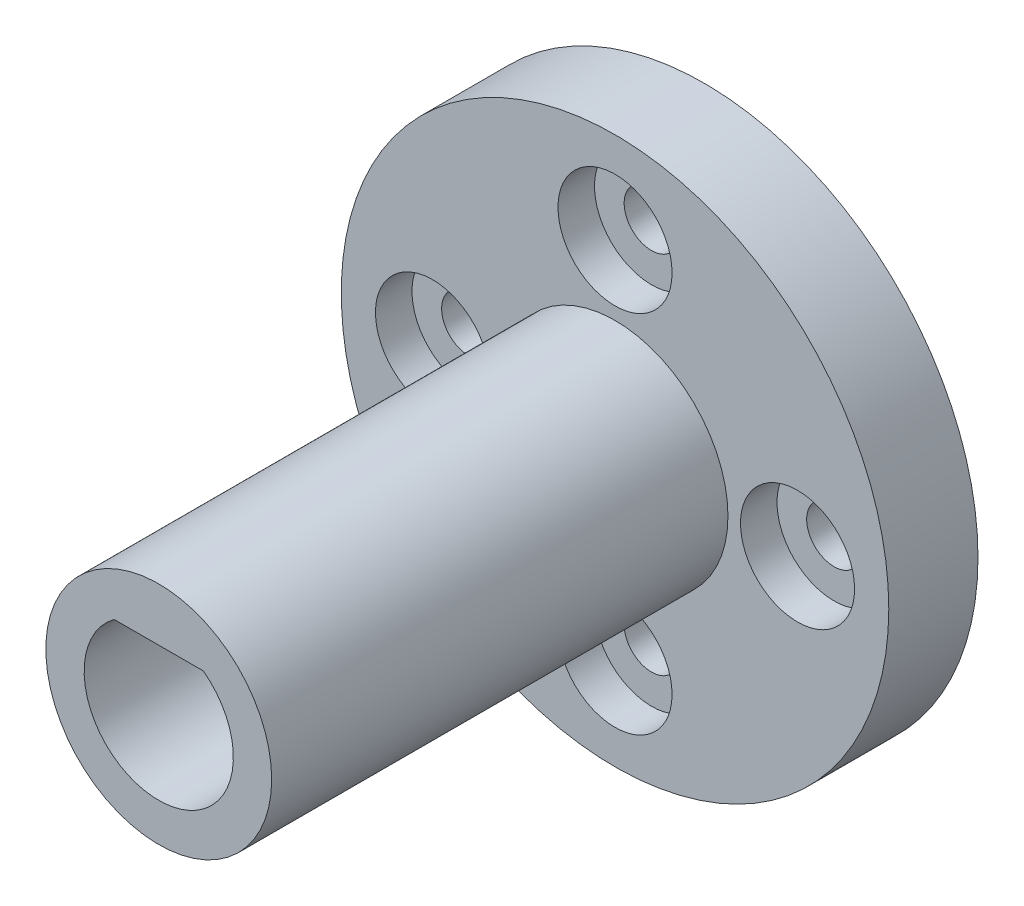
from build123d import *

# Parameters (mm, degrees)
ESQUISSE1_R                                        = 12
BOSS_EXTRU_1_DEPTH                                 = 3.91
ESQUISSE6_R                                        = 4
ENL_V_MAT_EXTRU_2_DEPTH                            = 1.91
BOSS_EXTRU_2_DEPTH                                 = 20
CHAMBRAGE_POUR_VIS_T_TE_RONDE_BOMB_E_M_D           = 2.4
CHAMBRAGE_POUR_VIS_T_TE_RONDE_BOMB_E_M_CBORE_D     = 5
CHAMBRAGE_POUR_VIS_T_TE_RONDE_BOMB_E_M_CBORE_DEPTH = 1.6
R_P_TITION_CIRCULAIRE2_COUNT                       = 4


with BuildPart() as part:
    # Esquisse1 → Boss.-Extru.1 (new body)
    with BuildSketch(Plane.XY):
        Circle(ESQUISSE1_R)
    extrude(amount=BOSS_EXTRU_1_DEPTH)

    # Esquisse6 → Enlèv. mat.-Extru.2 (cut)
    with BuildSketch(Plane(origin=(0, 0, 0), x_dir=(-1, 0, 0), z_dir=(0, 0, -1))):
        Circle(ESQUISSE6_R)
    extrude(amount=-ENL_V_MAT_EXTRU_2_DEPTH, mode=Mode.SUBTRACT)

    # Esquisse7 → Boss.-Extru.2 (add)
    # profile 1 of 2: a face of its own
    with BuildSketch(Plane.XY.offset(3.91)):
        with BuildLine():
            Line((-3.716127016, -3.27), (0, -3.27))
            Line((0, -3.27), (3.716127016, -3.27))
            ThreePointArc((3.716127016, -3.27), (4.631270276, -1.747522714), (4.95, 0))
            ThreePointArc((4.95, 0), (-1.747522714, 4.631270276), (-3.716127016, -3.27))
        make_face()
        with BuildLine():
            Line((-1.956655309, 2.62), (1.956655309, 2.62))
            ThreePointArc((1.956655309, 2.62), (3.103248298, -1.030897667), (0, -3.27))
            ThreePointArc((0, -3.27), (-3.103248298, -1.030897667), (-1.956655309, 2.62))
        make_face(mode=Mode.SUBTRACT)
    # profile 2 of 2: a face of its own
    with BuildSketch(Plane.XY.offset(3.91)):
        with BuildLine():
            Line((3.716127016, -3.27), (0, -3.27))
            Line((0, -3.27), (-3.716127016, -3.27))
            ThreePointArc((-3.716127016, -3.27), (0, -4.95), (3.716127016, -3.27))
        make_face()
    extrude(amount=BOSS_EXTRU_2_DEPTH)

    # Chambrage pour vis à tête ronde bombée M21 (through all)
    with Locations(Plane.XY.offset(3.91)):
        with Locations((0, 8)):
            chambrage_pour_vis_t_te_ronde_bomb_e_m = CounterBoreHole(CHAMBRAGE_POUR_VIS_T_TE_RONDE_BOMB_E_M_D / 2, CHAMBRAGE_POUR_VIS_T_TE_RONDE_BOMB_E_M_CBORE_D / 2, CHAMBRAGE_POUR_VIS_T_TE_RONDE_BOMB_E_M_CBORE_DEPTH)

    # Répétition circulaire2: Chambrage pour vis à tête ronde bombée M21 ×4 about axis
    r_p_tition_circulaire2_axis = Axis((0, 0, 0), (0, 0, 1))
    for i in range(1, R_P_TITION_CIRCULAIRE2_COUNT):
        add(chambrage_pour_vis_t_te_ronde_bomb_e_m.rotate(r_p_tition_circulaire2_axis, i * 360 / R_P_TITION_CIRCULAIRE2_COUNT), mode=Mode.SUBTRACT)


solid = part.part
